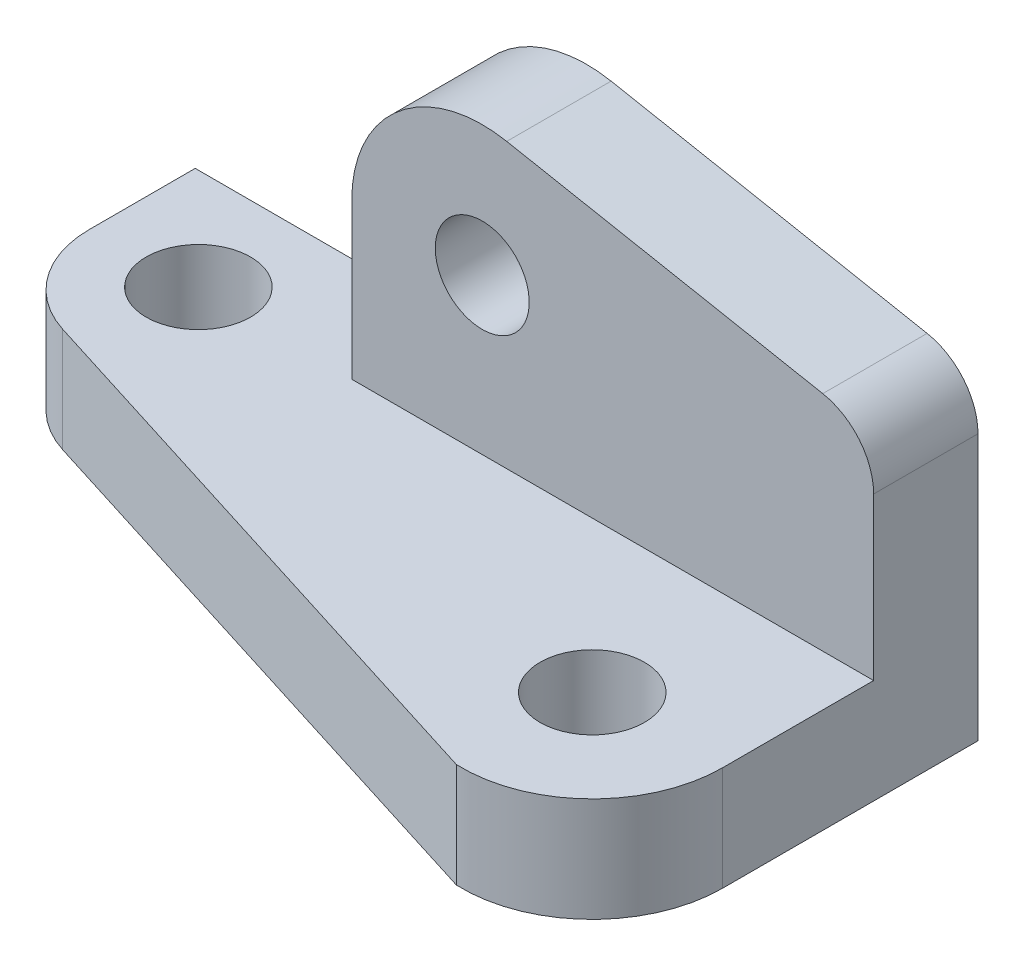
from build123d import *

# Parameters (mm, degrees)
SKETCH_1_R      = 10
EXTRUDE_1_DEPTH = 20
SKETCH_3_R      = 9
EXTRUDE_3_DEPTH = 20


with BuildPart() as part:
    # 草圖1 → 填料-伸長1 (new body)
    with BuildSketch(Plane(origin=(0, 0, 0), x_dir=(1, 0, 0), z_dir=(0, 1, 0))):
        with BuildLine():
            Line((0, 0), (150, 0))
            Line((150, 0), (150, -48.937372985))
            ThreePointArc((150, -48.937372985), (142.306045532, -66.979013377), (123.959936956, -73.915728993))
            Line((123.959936956, -73.915728993), (14.009507708, -39.398116187))
            ThreePointArc((14.009507708, -39.398116187), (3.878432988, -32.15252135), (0, -20.316344726))
            Line((0, -20.316344726), (0, 0))
        make_face()
        with Locations(Location((20, -19.398116187, 0), (0, 0, 270))):
            Circle(SKETCH_1_R, mode=Mode.SUBTRACT)
        with Locations(Location((125, -48.915728993, 0), (0, 0, 270))):
            Circle(SKETCH_1_R, mode=Mode.SUBTRACT)
    extrude(amount=EXTRUDE_1_DEPTH)

    # 草圖3 → 填料-伸長3 (add)
    with BuildSketch(Plane(origin=(0, 0, 0), x_dir=(-1, 0, 0), z_dir=(0, 0, -1))):
        with BuildLine():
            Line((-150, 20), (-150, 50.956093838))
            ThreePointArc((-150, 50.956093838), (-147.247819565, 58.603173888), (-140.253694451, 62.742563256))
            Line((-140.253694451, 62.742563256), (-79.695196774, 74.321972269))
            ThreePointArc((-79.695196774, 74.321972269), (-59.068583229, 69.033118411), (-50, 49.76682765))
            Line((-50, 49.76682765), (-50, 20))
            Line((-50, 20), (-150, 20))
        make_face()
        with Locations((-75, 49.76682765)):
            Circle(SKETCH_3_R, mode=Mode.SUBTRACT)
    extrude(amount=-EXTRUDE_3_DEPTH)


solid = part.part
